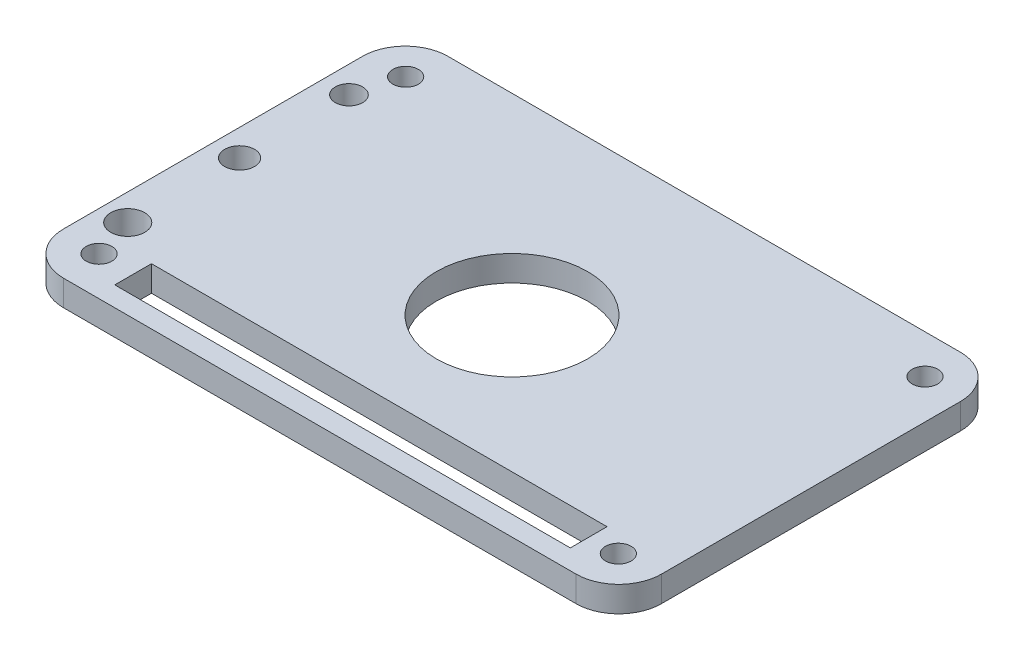
from build123d import *

# Parameters (mm, degrees)
SKETCH_1_R          = 1.5
EXTRUDE_1_DEPTH     = 3
SKETCH_2_R          = 8.856274186
SKETCH_2_R_2        = 1.600284684
SKETCH_2_R_3        = 1.750181187
SKETCH_2_R_4        = 1.993052337
SKETCH_2_W          = 53.334767433
SKETCH_2_H          = 4.299974178
CUT_EXTRUDE_1_DEPTH = 42.716303767


with BuildPart() as part:
    # 草图1 → 凸台-拉伸1 (new body)
    with BuildSketch(Plane(origin=(0, 0, 0), x_dir=(1, 0, 0), z_dir=(0, 1, 0))):
        with BuildLine():
            Line((-30, 22.5), (30, 22.5))
            ThreePointArc((30, 22.5), (33.535533906, 21.035533906), (35, 17.5))
            Line((35, 17.5), (35, -17.5))
            ThreePointArc((35, -17.5), (33.535533906, -21.035533906), (30, -22.5))
            Line((30, -22.5), (-30, -22.5))
            ThreePointArc((-30, -22.5), (-33.535533906, -21.035533906), (-35, -17.5))
            Line((-35, -17.5), (-35, 17.5))
            ThreePointArc((-35, 17.5), (-33.535533906, 21.035533906), (-30, 22.5))
        make_face()
        with Locations(Location((-30.4, -17.95, 0), (0, 0, 270))):
            Circle(SKETCH_1_R, mode=Mode.SUBTRACT)
        with Locations(Location((30.4, -17.95, 0), (0, 0, 90))):
            Circle(SKETCH_1_R, mode=Mode.SUBTRACT)
        with Locations(Location((30.4, 17.95, 0), (0, 0, 270))):
            Circle(SKETCH_1_R, mode=Mode.SUBTRACT)
        with Locations(Location((-30.4, 17.95, 0), (0, 0, 90))):
            Circle(SKETCH_1_R, mode=Mode.SUBTRACT)
    extrude(amount=EXTRUDE_1_DEPTH)

    # 草图2 → 切除-拉伸1 (cut, through all)
    with BuildSketch(Plane(origin=(0, 3, 0), x_dir=(1, 0, 0), z_dir=(0, 1, 0))):
        with Locations(Location((0, 0, 0), (0, 0, 270))):
            Circle(SKETCH_2_R)
        with Locations(Location((-31.892993618, 12.805189582, 0), (0, 0, 270))):
            Circle(SKETCH_2_R_2)
        with Locations(Location((-31.892993618, 0, 0), (0, 0, 270))):
            Circle(SKETCH_2_R_3)
        with Locations(Location((-31.892993618, -13.094810418, 0), (0, 0, 270))):
            Circle(SKETCH_2_R_4)
        with Locations((0.339471646, -18.029716289)):
            Rectangle(SKETCH_2_W, SKETCH_2_H)
    extrude(amount=-CUT_EXTRUDE_1_DEPTH, mode=Mode.SUBTRACT)


solid = part.part
